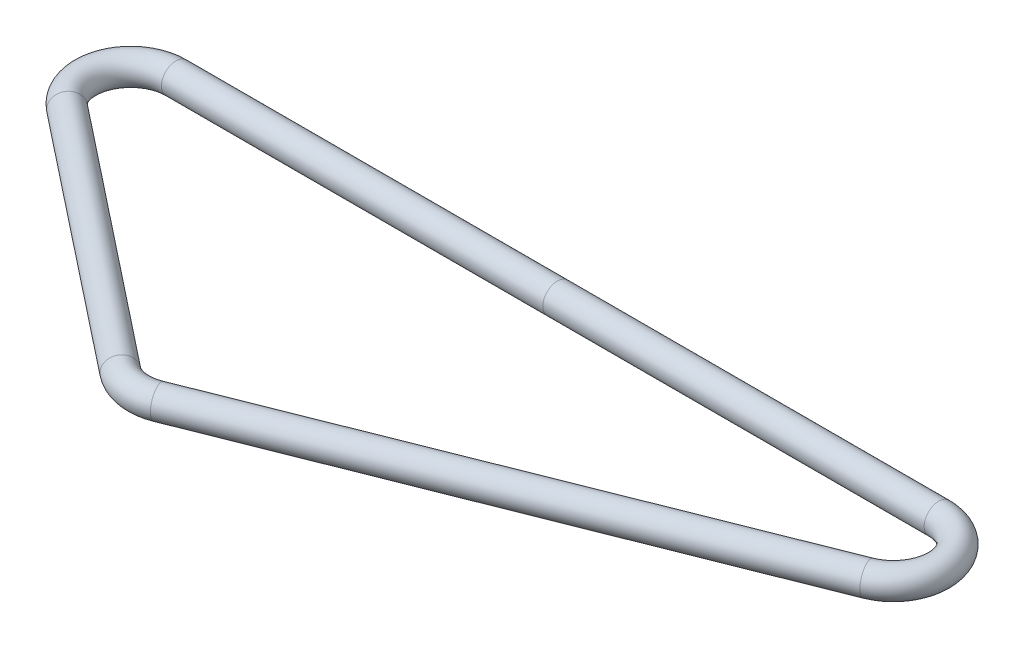
from build123d import *

# Parameters (mm, degrees)
SKETCH5_R = 2.20345


with BuildPart() as part:
    # Sweep1: sweep along a path in Sketch4
    with BuildLine(Plane(origin=(0, 0, 0), x_dir=(1, 0, 0), z_dir=(0, 1, 0))) as sweep1_path:
        Line((-16.580463347, -43.668300146), (60.14311778, -13.20529637))
        ThreePointArc((60.14311778, -13.20529637), (64.33977461, -5.558453877), (57.617444719, 0))
        Line((57.617444719, 0), (-57.617444719, 0))
        ThreePointArc((-57.617444719, 0), (-64.082016731, -4.596488378), (-61.863495708, -12.21203571))
        Line((-61.863495708, -12.21203571), (-23.352187398, -42.675039486))
        ThreePointArc((-23.352187398, -42.675039486), (-20.099397068, -44.078908812), (-16.580463347, -43.668300146))
    # Sketch5 → Sweep1 (sweep)
    with BuildSketch(Plane(origin=(0, 0, 0), x_dir=(0, 0, -1), z_dir=(1, 0, 0))):
        Circle(SKETCH5_R)
    sweep(path=sweep1_path.line)


solid = part.part
